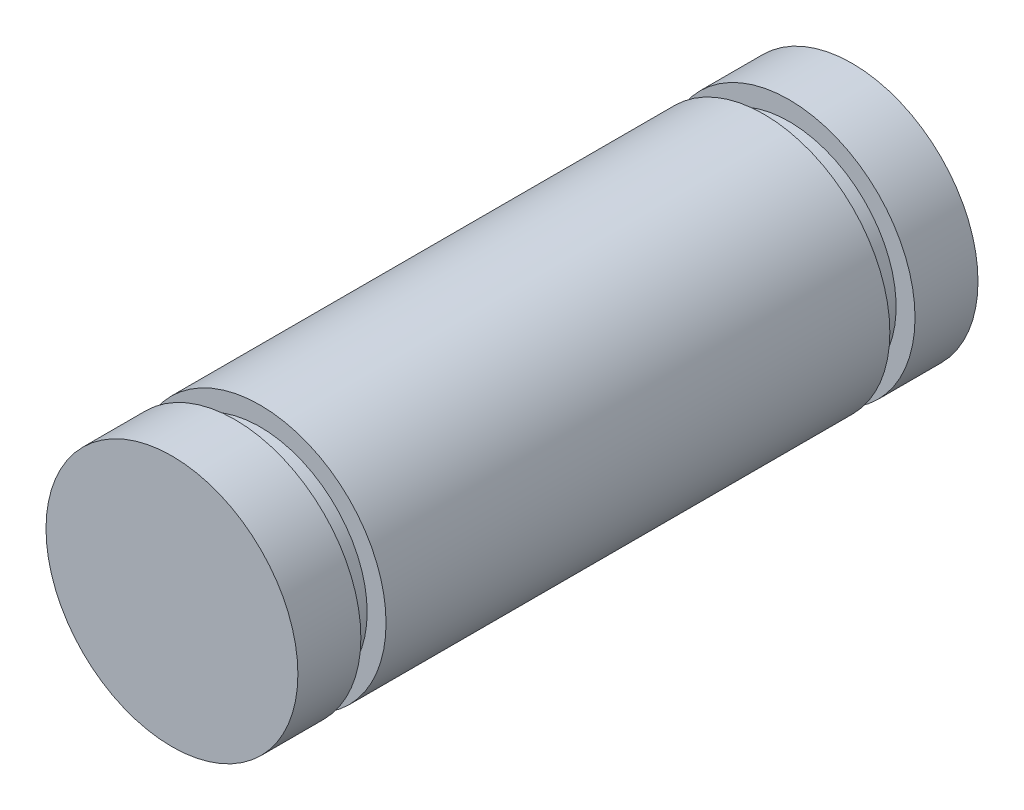
from build123d import *

# Parameters (mm, degrees)
SKETCH1_R           = 10
BOSS_EXTRUDE1_DEPTH = 40
SKETCH2_R           = 8.5
BOSS_EXTRUDE2_DEPTH = 2
SKETCH4_R           = 10
BOSS_EXTRUDE3_DEPTH = 5
BOSS_EXTRUDE4_START = 2
SKETCH5_R           = 8.5
BOSS_EXTRUDE4_DEPTH = 2
BOSS_EXTRUDE5_START = 5
SKETCH6_R           = 10
BOSS_EXTRUDE5_DEPTH = 5


with BuildPart() as part:
    # Sketch1 → Boss-Extrude1 (new body)
    with BuildSketch(Plane.XY):
        Circle(SKETCH1_R)
    extrude(amount=BOSS_EXTRUDE1_DEPTH)

    # Sketch2 → Boss-Extrude2 (add)
    with BuildSketch(Plane.XY.offset(40)):
        Circle(SKETCH2_R)
    extrude(amount=BOSS_EXTRUDE2_DEPTH)

    # Sketch4 → Boss-Extrude3 (add)
    with BuildSketch(Plane.XY.offset(42)):
        Circle(SKETCH4_R)
    extrude(amount=BOSS_EXTRUDE3_DEPTH)

    # Sketch5 → Boss-Extrude4 (add)
    with BuildSketch(Plane(origin=(0, 0, 0), x_dir=(-1, 0, 0), z_dir=(0, 0, -1)).offset(BOSS_EXTRUDE4_START)):
        with Locations(Location((0, 0, 0), (0, 0, 180))):
            Circle(SKETCH5_R)
    extrude(amount=-BOSS_EXTRUDE4_DEPTH)

    # Sketch6 → Boss-Extrude5 (add)
    with BuildSketch(Plane(origin=(0, 0, -2), x_dir=(-1, 0, 0), z_dir=(0, 0, -1)).offset(BOSS_EXTRUDE5_START)):
        with Locations(Location((0, 0, 0), (0, 0, 180))):
            Circle(SKETCH6_R)
    extrude(amount=-BOSS_EXTRUDE5_DEPTH)


solid = part.part
